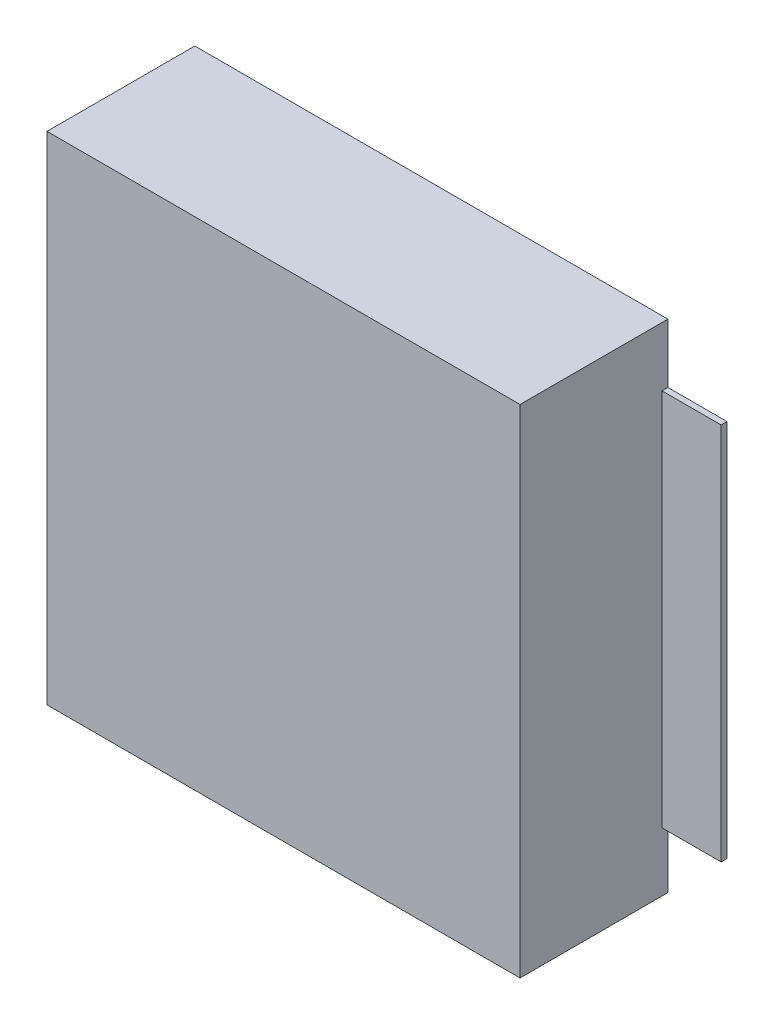
from build123d import *

# Parameters (mm, degrees)
CROQUIS1_W              = 80
CROQUIS1_H              = 84
SALIENTE_EXTRUIR1_DEPTH = 25
CROQUIS4_W              = 10
CROQUIS4_H              = 84
SALIENTE_EXTRUIR3_DEPTH = 1
CROQUIS11_W             = 10
CROQUIS11_H             = 10
CORTAR_EXTRUIR1_DEPTH   = 1
CROQUIS8_W              = 10
CROQUIS8_H              = 10
CORTAR_EXTRUIR2_DEPTH   = 1


with BuildPart() as part:
    # Croquis1 → Saliente-Extruir1 (new body)
    with BuildSketch(Plane.XY):
        Rectangle(CROQUIS1_W, CROQUIS1_H)
    extrude(amount=SALIENTE_EXTRUIR1_DEPTH)

    # Croquis4 → Saliente-Extruir3 (add)
    with BuildSketch(Plane(origin=(0, 0, 0), x_dir=(-1, 0, 0), z_dir=(0, 0, -1))):
        with Locations((-45, 0)):
            Rectangle(CROQUIS4_W, CROQUIS4_H)
        with Locations((45, 0)):
            Rectangle(CROQUIS4_W, CROQUIS4_H)
    extrude(amount=-SALIENTE_EXTRUIR3_DEPTH)

    # Croquis11 → Cortar-Extruir1 (cut)
    with BuildSketch(Plane.XY.offset(1)):
        with Locations((-45, 37)):
            Rectangle(CROQUIS11_W, CROQUIS11_H)
        with Locations((-45, -37)):
            Rectangle(CROQUIS11_W, CROQUIS11_H)
    extrude(amount=-CORTAR_EXTRUIR1_DEPTH, mode=Mode.SUBTRACT)

    # Croquis8 → Cortar-Extruir2 (cut)
    with BuildSketch(Plane.XY.offset(1)):
        with Locations((45, 37)):
            Rectangle(CROQUIS8_W, CROQUIS8_H)
        with Locations((45, -37)):
            Rectangle(CROQUIS8_W, CROQUIS8_H)
    extrude(amount=-CORTAR_EXTRUIR2_DEPTH, mode=Mode.SUBTRACT)


solid = part.part
